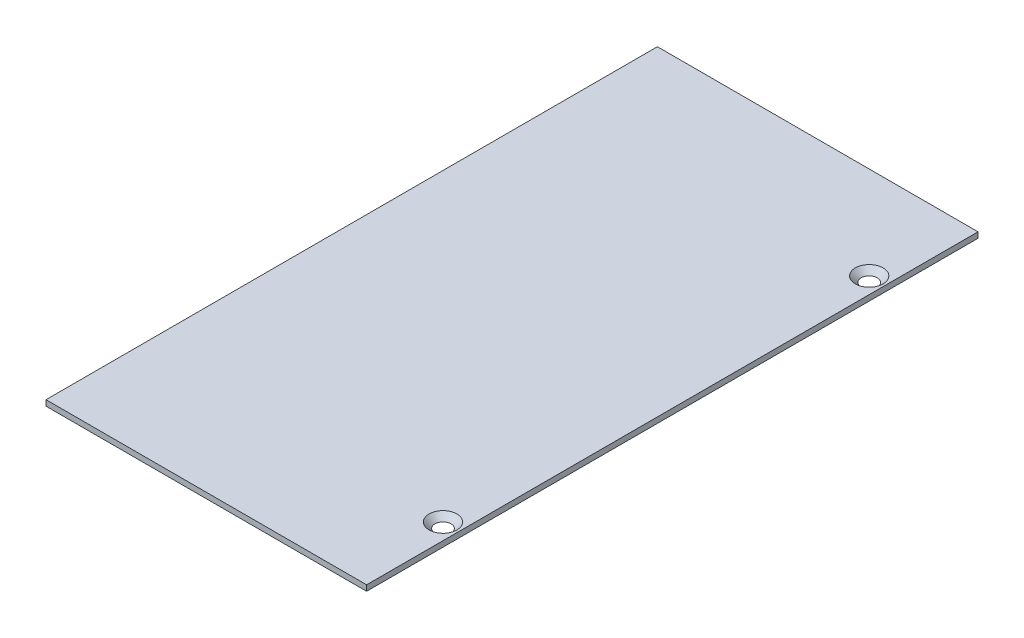
from build123d import *

# Parameters (mm, degrees)
SKETCH1_W                                            = 69.24
SKETCH1_H                                            = 132.04
BOSS_EXTRUDE1_DEPTH                                  = 1.2192
CSK_FOR_M3_CROSS_COUNTERSUNK_HEAD_SCREW1_D           = 3.4
CSK_FOR_M3_CROSS_COUNTERSUNK_HEAD_SCREW1_DEPTH       = 70.76
CSK_FOR_M3_CROSS_COUNTERSUNK_HEAD_SCREW1_CSINK_D     = 6
CSK_FOR_M3_CROSS_COUNTERSUNK_HEAD_SCREW1_CSINK_ANGLE = 92
CSK_FOR_M3_CROSS_COUNTERSUNK_HEAD_SCREW1_TIP         = 1.021463052


with BuildPart() as part:
    # Sketch1 → Boss-Extrude1 (new body)
    with BuildSketch(Plane(origin=(0, 0, 0), x_dir=(1, 0, 0), z_dir=(0, 1, 0))):
        with Locations((34.62, 66.02)):
            Rectangle(SKETCH1_W, SKETCH1_H)
    extrude(amount=BOSS_EXTRUDE1_DEPTH)

    # CSK for M3 Cross Countersunk Head Screw1
    with Locations(Plane(origin=(0, 1.2192, 0), x_dir=(1, 0, 0), z_dir=(0, 1, 0))):
        with Locations((65.74, 112.04), (65.74, 20)):
            CounterSinkHole(CSK_FOR_M3_CROSS_COUNTERSUNK_HEAD_SCREW1_D / 2, CSK_FOR_M3_CROSS_COUNTERSUNK_HEAD_SCREW1_CSINK_D / 2, depth=CSK_FOR_M3_CROSS_COUNTERSUNK_HEAD_SCREW1_DEPTH, counter_sink_angle=CSK_FOR_M3_CROSS_COUNTERSUNK_HEAD_SCREW1_CSINK_ANGLE)
            with Locations((0, 0, -(CSK_FOR_M3_CROSS_COUNTERSUNK_HEAD_SCREW1_DEPTH + CSK_FOR_M3_CROSS_COUNTERSUNK_HEAD_SCREW1_TIP / 2))):  # 118° drill point
                Cone(0, CSK_FOR_M3_CROSS_COUNTERSUNK_HEAD_SCREW1_D / 2, CSK_FOR_M3_CROSS_COUNTERSUNK_HEAD_SCREW1_TIP, mode=Mode.SUBTRACT)


solid = part.part
